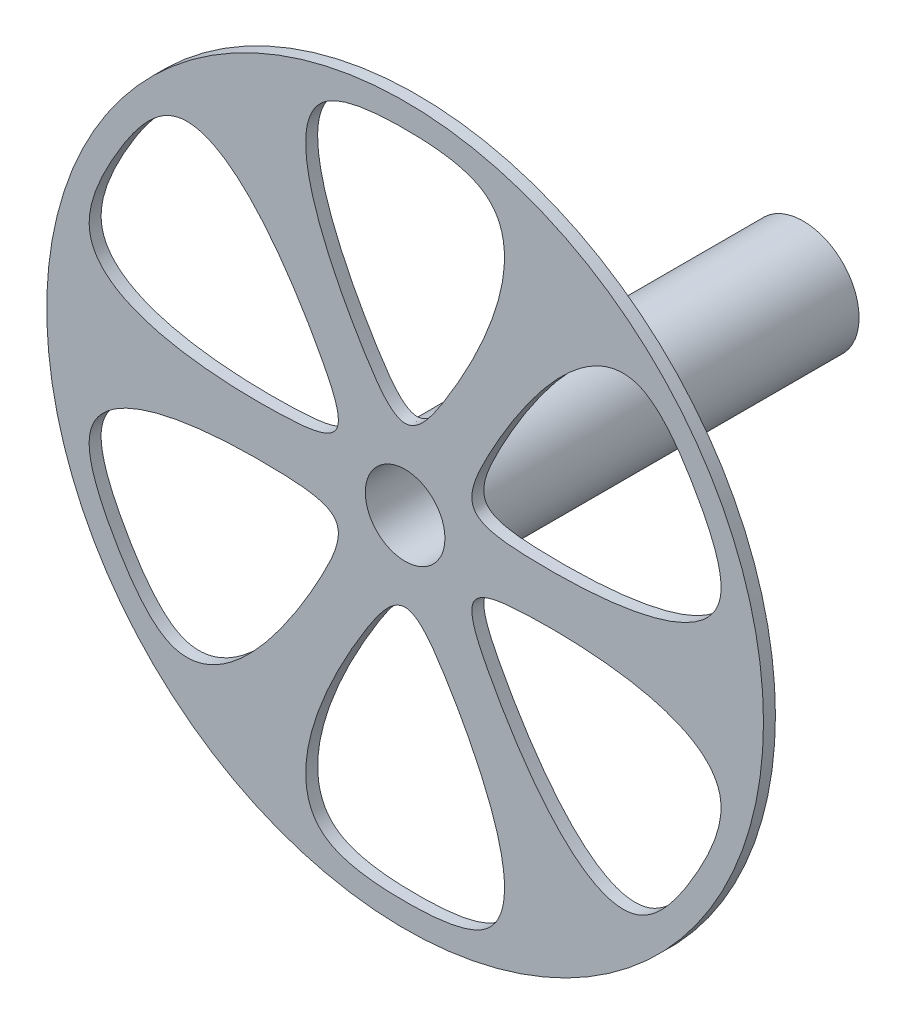
from build123d import *

# Parameters (mm, degrees)
SKETCH1_R           = 45
SKETCH1_R_2         = 5
BOSS_EXTRUDE1_DEPTH = 1.5
BOSS_EXTRUDE2_START = -50
SKETCH2_R           = 7
SKETCH2_R_2         = 5
BOSS_EXTRUDE2_DEPTH = 50


with BuildPart() as part:
    # Sketch1 → Boss-Extrude1 (new body)
    with BuildSketch(Plane.XY):
        Circle(SKETCH1_R)
        Circle(SKETCH1_R_2, mode=Mode.SUBTRACT)
        with BuildLine():
            add(Edge.make_bspline(
                [(-5, 15), (-10.81459924, 24.333983955), (-17.481193162, 40.633203209), (0, 42.390513369), (17.481193162, 40.633203209), (9.493898899, 21.104991056), (0, 7.588781366), (-3.38732033, 12.411218634), (-5, 15)],
                knots=[0, 0, 0, 0, 0.29808923, 0.417324923, 0.536560615, 0.834649845, 0.917324923, 1, 1, 1, 1], degree=3))
        make_face(mode=Mode.SUBTRACT)
        with BuildLine():
            add(Edge.make_bspline(
                [(10.490381057, 11.830127019), (15.666548661, 21.532709652), (26.448789635, 35.455758972), (36.711261457, 21.195256684), (43.929982797, 5.177444237), (23.024407851, 2.330537901), (6.572077447, 3.794390683), (9.054770464, 9.139114774), (10.490381057, 11.830127019)],
                knots=[0, 0, 0, 0, 0.29808923, 0.417324923, 0.536560615, 0.834649845, 0.917324923, 1, 1, 1, 1], degree=3))
        make_face(mode=Mode.SUBTRACT)
        with BuildLine():
            add(Edge.make_bspline(
                [(15.490381057, -3.169872981), (26.481147901, -2.801274304), (43.929982797, -5.177444237), (36.711261457, -21.195256684), (26.448789635, -35.455758972), (13.530508952, -18.774453155), (6.572077447, -3.794390683), (12.442090794, -3.27210386), (15.490381057, -3.169872981)],
                knots=[0, 0, 0, 0, 0.29808923, 0.417324923, 0.536560615, 0.834649845, 0.917324923, 1, 1, 1, 1], degree=3))
        make_face(mode=Mode.SUBTRACT)
        with BuildLine():
            add(Edge.make_bspline(
                [(5, -15), (10.81459924, -24.333983955), (17.481193162, -40.633203209), (0, -42.390513369), (-17.481193162, -40.633203209), (-9.493898899, -21.104991056), (0, -7.588781366), (3.38732033, -12.411218634), (5, -15)],
                knots=[0, 0, 0, 0, 0.29808923, 0.417324923, 0.536560615, 0.834649845, 0.917324923, 1, 1, 1, 1], degree=3))
        make_face(mode=Mode.SUBTRACT)
        with BuildLine():
            add(Edge.make_bspline(
                [(-10.490381057, -11.830127019), (-15.666548661, -21.532709652), (-26.448789635, -35.455758972), (-36.711261457, -21.195256684), (-43.929982797, -5.177444237), (-23.024407851, -2.330537901), (-6.572077447, -3.794390683), (-9.054770464, -9.139114774), (-10.490381057, -11.830127019)],
                knots=[0, 0, 0, 0, 0.29808923, 0.417324923, 0.536560615, 0.834649845, 0.917324923, 1, 1, 1, 1], degree=3))
        make_face(mode=Mode.SUBTRACT)
        with BuildLine():
            add(Edge.make_bspline(
                [(-15.490381057, 3.169872981), (-26.481147901, 2.801274304), (-43.929982797, 5.177444237), (-36.711261457, 21.195256684), (-26.448789635, 35.455758972), (-13.530508952, 18.774453155), (-6.572077447, 3.794390683), (-12.442090794, 3.27210386), (-15.490381057, 3.169872981)],
                knots=[0, 0, 0, 0, 0.29808923, 0.417324923, 0.536560615, 0.834649845, 0.917324923, 1, 1, 1, 1], degree=3))
        make_face(mode=Mode.SUBTRACT)
    extrude(amount=BOSS_EXTRUDE1_DEPTH)

    # Sketch2 → Boss-Extrude2 (add)
    with BuildSketch(Plane.XY.offset(1.5).offset(BOSS_EXTRUDE2_START)):
        Circle(SKETCH2_R)
        Circle(SKETCH2_R_2, mode=Mode.SUBTRACT)
    extrude(amount=BOSS_EXTRUDE2_DEPTH)


solid = part.part
